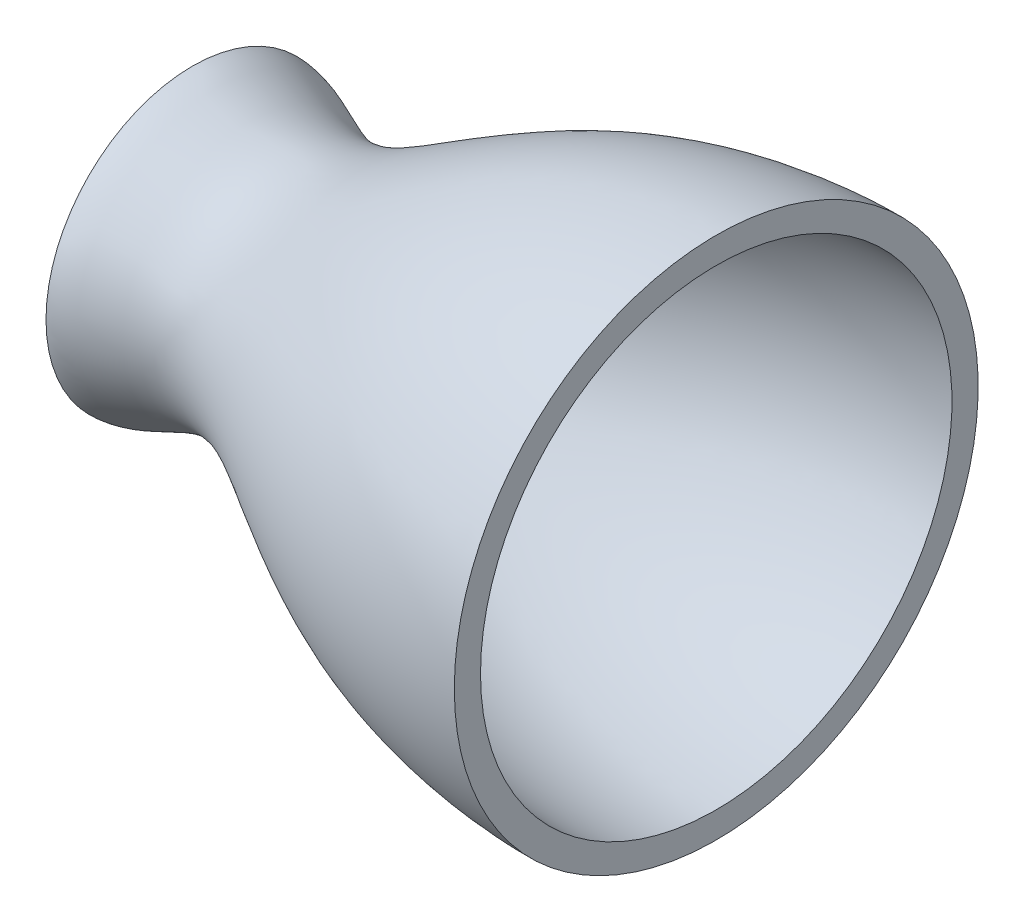
from build123d import *


with BuildPart() as part:
    # Sketch2 → Revolve3 (revolve)
    with BuildSketch(Plane.XY):
        with BuildLine():
            add(Edge.make_bspline(
                [(0, 0), (12.664363865, 0), (40.344464525, -12.46651206), (102.969698775, -37.562198246), (196.570831128, 19.719259413), (321.271341379, 89.305673825), (435.244637534, 110.28860769), (500, 110.28860769)],
                knots=[0, 0, 0, 0, 0.073976351, 0.164364943, 0.371180183, 0.629474053, 1, 1, 1, 1], degree=3))
            Line((0, 0), (0, -25))
            add(Edge.make_bspline(
                [(0, -25), (12.664363865, -25), (40.344464525, -37.46651206), (102.969698775, -62.562198246), (196.570831128, -5.280740587), (321.271341379, 64.305673825), (435.244637534, 85.28860769), (500, 85.28860769)],
                knots=[0, 0, 0, 0, 0.073976351, 0.164364943, 0.371180183, 0.629474053, 1, 1, 1, 1], degree=3))
            Line((500, 85.28860769), (500, 110.28860769))
        make_face()
    revolve(axis=Axis((0, -139.71139231, 0), (1, 0, 0)))


solid = part.part
